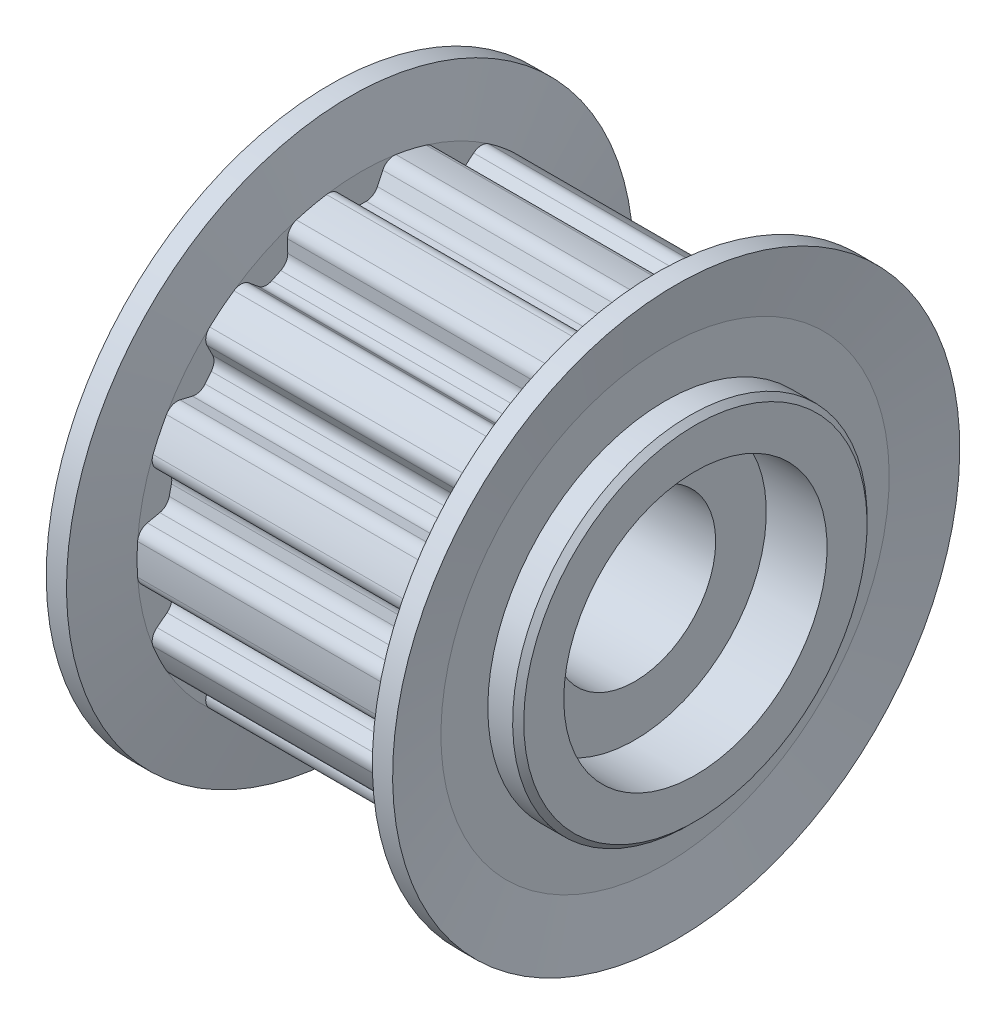
from build123d import *

# Parameters (mm, degrees)
CUT_EXTRUDE_START        = 16.5
CUT_EXTRUDE_1_DEPTH      = 14
PATTERN_CIRCULAR_1_COUNT = 14
SKETCH_6_R               = 4
CUT_EXTRUDE_2_DEPTH      = 28.440845468
CHAMFER_1_SIZE           = 0.18
SKETCH_10_W              = 3
SKETCH_10_H              = 6.5


with BuildPart() as part:
    # 草图3 → 旋转1 (revolve)
    with BuildSketch(Plane.XY):
        Polygon((0, 0), (0, 8.475), (0.275, 8.75), (2.5, 8.75), (2.5, 11.065), (16.5, 11.065), (16.5, 8.75), (18.725, 8.75), (19, 8.475), (19, 0), align=None)
    revolve(axis=Axis((19, 0, 0), (-1, 0, 0)))

    # 草图4 → Cut-Extrude 1 (cut)
    with BuildSketch(Plane(origin=(0, 0, 0), x_dir=(0, 0, -1), z_dir=(1, 0, 0)).offset(CUT_EXTRUDE_START)):
        with BuildLine():
            Line((-0.246387141, 9.665), (0.246387141, 9.665))
            ThreePointArc((0.246387141, 9.665), (0.574139902, 9.760531218), (0.799234891, 10.01720286))
            Line((0.799234891, 10.01720286), (1.064880338, 10.58688136))
            ThreePointArc((1.064880338, 10.58688136), (1.330886548, 10.867435343), (1.712114902, 10.931737628))
            ThreePointArc((1.712114902, 10.931737628), (0, 11.065), (-1.712114902, 10.931737628))
            ThreePointArc((-1.712114902, 10.931737628), (-1.330886548, 10.867435343), (-1.064880338, 10.58688136))
            Line((-1.064880338, 10.58688136), (-0.799234891, 10.01720286))
            ThreePointArc((-0.799234891, 10.01720286), (-0.574139902, 9.760531218), (-0.246387141, 9.665))
        make_face()
    cut_extrude_1 = extrude(amount=-CUT_EXTRUDE_1_DEPTH, mode=Mode.SUBTRACT)

    # 阵列(圆周)1: Cut-Extrude 1 ×14 about axis
    pattern_circular_1_axis = Axis((0, 0, 0), (1, 0, 0))
    for i in range(1, PATTERN_CIRCULAR_1_COUNT):
        add(cut_extrude_1.rotate(pattern_circular_1_axis, i * 360 / PATTERN_CIRCULAR_1_COUNT), mode=Mode.SUBTRACT)

    # 草图5 → 旋转2 (revolve)
    with BuildSketch(Plane.XY, mode=Mode.PRIVATE) as revolve_2_sk:
        Polygon((1.95, 14), (2.5, 11.065), (2.5, 8.75), (1.5, 8.75), (1.5, 11.065), (0.95, 14), align=None)
        Polygon((17.5, 8.75), (16.5, 8.75), (16.5, 11.065), (17.05, 14), (18.05, 14), (17.5, 11.065), align=None)
    revolve(revolve_2_sk.sketch.rotate(Axis((0, 0, 0), (1, 0, 0)), 180), axis=Axis((0, 0, 0), (1, 0, 0)))

    # 草图6 → 切除-拉伸2 (cut, through all)
    with BuildSketch(Plane(origin=(0, 0, 0), x_dir=(0, 0, -1), z_dir=(1, 0, 0))):
        Circle(SKETCH_6_R)
    extrude(amount=CUT_EXTRUDE_2_DEPTH, mode=Mode.SUBTRACT)

    # 倒角1
    chamfer_1_edges = [part.edges().sort_by_distance(p)[0] for p in [
        (0, 0, 4),
        (19, 0, 4),
    ]]
    chamfer(chamfer_1_edges, length=CHAMFER_1_SIZE)

    # 草图10 → Cut-Revolve 8317 (revolve, cut)
    with BuildSketch(Plane.XY, mode=Mode.PRIVATE) as cut_revolve_8317_sk:
        with Locations((17.5, 3.25)):
            Rectangle(SKETCH_10_W, SKETCH_10_H)
        with Locations((1.5, 3.25)):
            Rectangle(SKETCH_10_W, SKETCH_10_H)
    revolve(cut_revolve_8317_sk.sketch.rotate(Axis((0, 0, 0), (1, 0, 0)), 90), axis=Axis((0, 0, 0), (1, 0, 0)), mode=Mode.SUBTRACT)


solid = part.part
